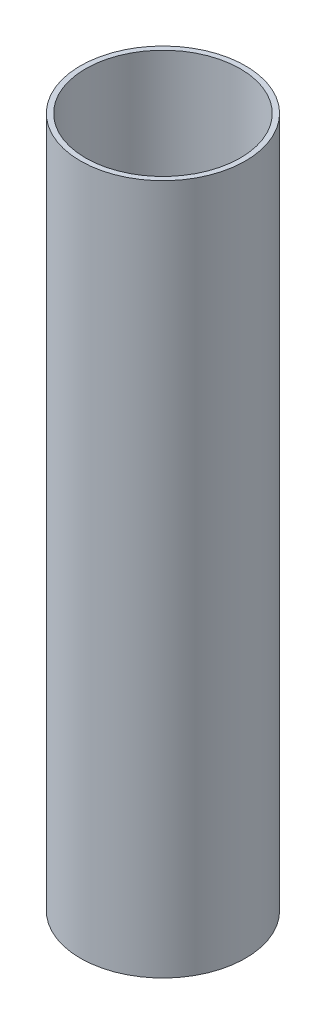
from build123d import *

# Parameters (mm, degrees)
SKETCH1_R           = 40
SKETCH1_R_2         = 37.5
BOSS_EXTRUDE1_DEPTH = 334.8


with BuildPart() as part:
    # Sketch1 → Boss-Extrude1 (new body)
    with BuildSketch(Plane(origin=(0, 0, 0), x_dir=(1, 0, 0), z_dir=(0, 1, 0))):
        with Locations(Location((0, 0, 0), (0, 0, 270))):
            Circle(SKETCH1_R)
        with Locations(Location((0, 0, 0), (0, 0, 270))):
            Circle(SKETCH1_R_2, mode=Mode.SUBTRACT)
    extrude(amount=BOSS_EXTRUDE1_DEPTH)


solid = part.part
